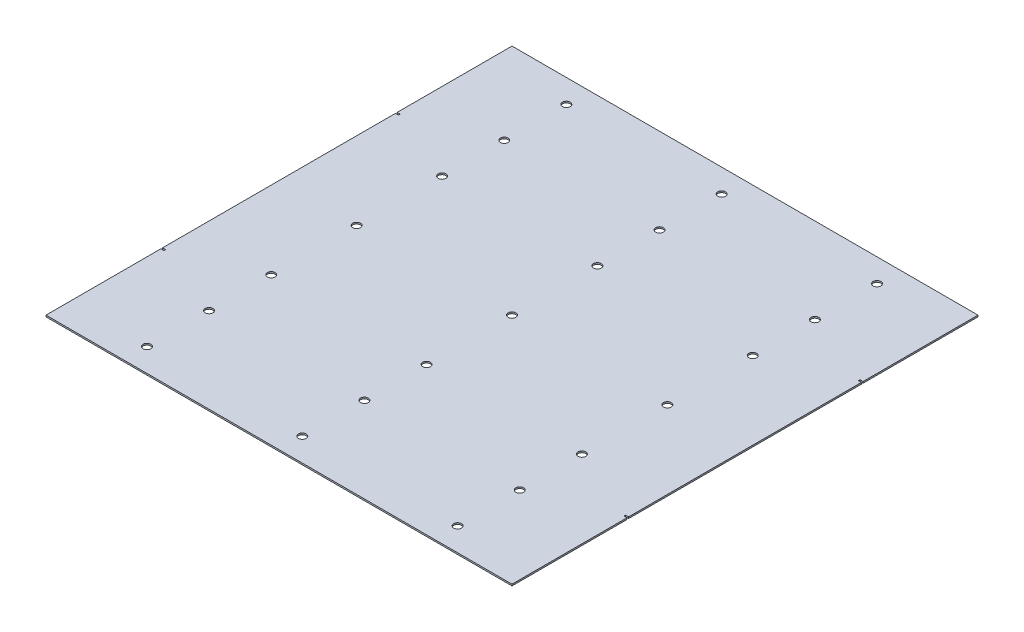
from build123d import *

# Parameters (mm, degrees)
SKETCH1_R           = 2.5
BOSS_EXTRUDE1_DEPTH = 1


with BuildPart() as part:
    # Sketch1 → Boss-Extrude1 (new body)
    with BuildSketch(Plane(origin=(0, 0, 0), x_dir=(1, 0, 0), z_dir=(0, 1, 0))):
        Polygon((0, 0), (0, 74), (2, 74), (2, 75), (0, 75), (0, 225), (2, 225), (2, 226), (0, 226), (0, 300), (300, 300), (300, 226), (298, 226), (298, 225), (300, 225), (300, 75), (298, 75), (298, 74), (300, 74), (300, 0), align=None)
        with Locations(Location((50, 285, 0), (0, 0, 270))):
            Circle(SKETCH1_R, mode=Mode.SUBTRACT)
        with Locations(Location((50, 245, 0), (0, 0, 270))):
            Circle(SKETCH1_R, mode=Mode.SUBTRACT)
        with Locations(Location((50, 205, 0), (0, 0, 270))):
            Circle(SKETCH1_R, mode=Mode.SUBTRACT)
        with Locations(Location((50, 150, 0), (0, 0, 270))):
            Circle(SKETCH1_R, mode=Mode.SUBTRACT)
        with Locations(Location((50, 95, 0), (0, 0, 270))):
            Circle(SKETCH1_R, mode=Mode.SUBTRACT)
        with Locations(Location((50, 55, 0), (0, 0, 270))):
            Circle(SKETCH1_R, mode=Mode.SUBTRACT)
        with Locations(Location((50, 15, 0), (0, 0, 270))):
            Circle(SKETCH1_R, mode=Mode.SUBTRACT)
        with Locations(Location((150, 15, 0), (0, 0, 270))):
            Circle(SKETCH1_R, mode=Mode.SUBTRACT)
        with Locations(Location((150, 55, 0), (0, 0, 270))):
            Circle(SKETCH1_R, mode=Mode.SUBTRACT)
        with Locations(Location((150, 95, 0), (0, 0, 270))):
            Circle(SKETCH1_R, mode=Mode.SUBTRACT)
        with Locations(Location((150, 150, 0), (0, 0, 270))):
            Circle(SKETCH1_R, mode=Mode.SUBTRACT)
        with Locations(Location((150, 205, 0), (0, 0, 270))):
            Circle(SKETCH1_R, mode=Mode.SUBTRACT)
        with Locations(Location((150, 245, 0), (0, 0, 270))):
            Circle(SKETCH1_R, mode=Mode.SUBTRACT)
        with Locations(Location((150, 285, 0), (0, 0, 270))):
            Circle(SKETCH1_R, mode=Mode.SUBTRACT)
        with Locations(Location((250, 15, 0), (0, 0, 270))):
            Circle(SKETCH1_R, mode=Mode.SUBTRACT)
        with Locations(Location((250, 55, 0), (0, 0, 270))):
            Circle(SKETCH1_R, mode=Mode.SUBTRACT)
        with Locations(Location((250, 95, 0), (0, 0, 270))):
            Circle(SKETCH1_R, mode=Mode.SUBTRACT)
        with Locations(Location((250, 150, 0), (0, 0, 270))):
            Circle(SKETCH1_R, mode=Mode.SUBTRACT)
        with Locations(Location((250, 205, 0), (0, 0, 270))):
            Circle(SKETCH1_R, mode=Mode.SUBTRACT)
        with Locations(Location((250, 245, 0), (0, 0, 270))):
            Circle(SKETCH1_R, mode=Mode.SUBTRACT)
        with Locations(Location((250, 285, 0), (0, 0, 270))):
            Circle(SKETCH1_R, mode=Mode.SUBTRACT)
    extrude(amount=BOSS_EXTRUDE1_DEPTH)


solid = part.part
